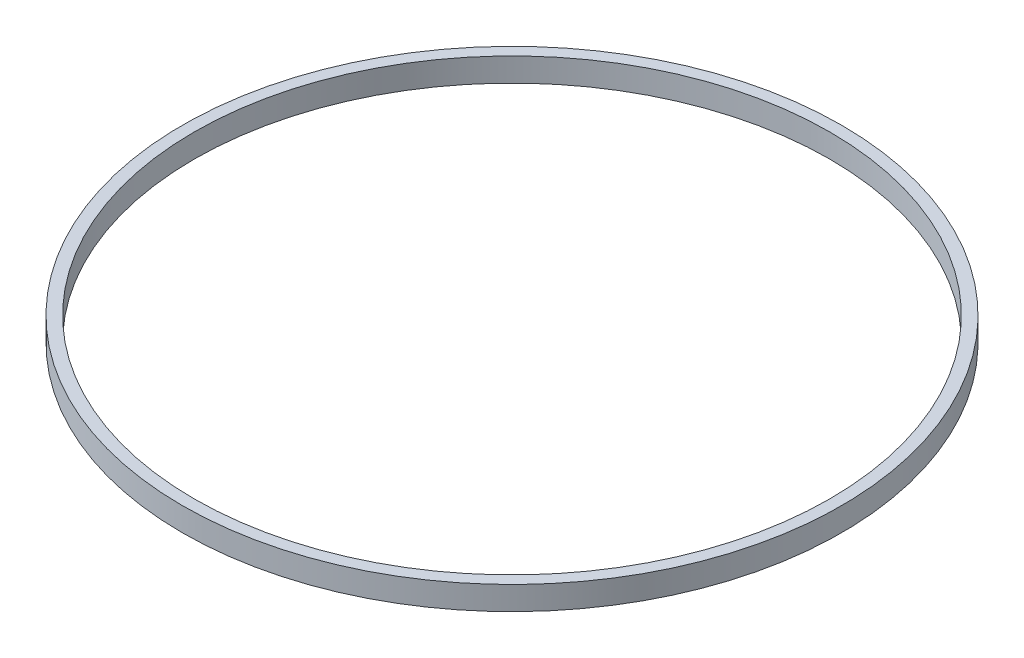
from build123d import *

# Parameters (mm, degrees)
SKETCH1_R           = 70
SKETCH1_R_2         = 67.5
BOSS_EXTRUDE1_DEPTH = 2.5


with BuildPart() as part:
    # Sketch1 → Boss-Extrude1 (new, symmetric)
    with BuildSketch(Plane(origin=(0, 0, 0), x_dir=(1, 0, 0), z_dir=(0, 1, 0))):
        with Locations(Location((0, 0, 0), (0, 0, 270))):
            Circle(SKETCH1_R)
        with Locations(Location((0, 0, 0), (0, 0, 270))):
            Circle(SKETCH1_R_2, mode=Mode.SUBTRACT)
    extrude(amount=BOSS_EXTRUDE1_DEPTH, both=True)


solid = part.part
